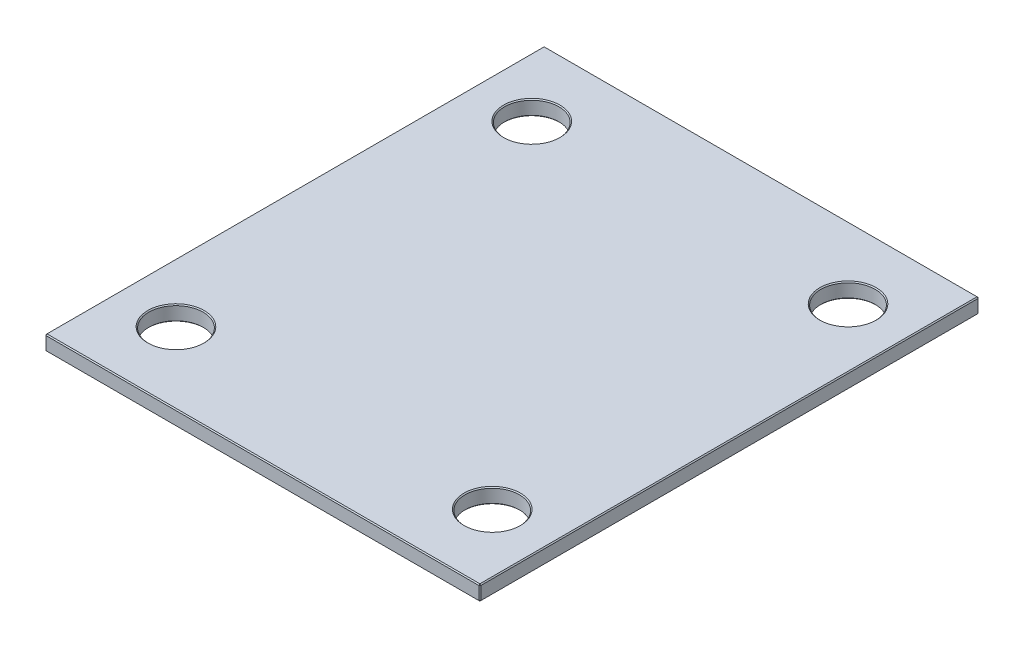
from build123d import *

# Parameters (mm, degrees)
SKETCH1_W           = 44
SKETCH1_H           = 50.5
SKETCH1_R           = 2.75
BOSS_EXTRUDE1_DEPTH = 1.524
CHAMFER1_SIZE       = 0.1


with BuildPart() as part:
    # Sketch1 → Boss-Extrude1 (new body)
    with BuildSketch(Plane(origin=(0, 0, 0), x_dir=(1, 0, 0), z_dir=(0, 1, 0))):
        Rectangle(SKETCH1_W, SKETCH1_H)
        with Locations(Location((-16, -18, 0), (0, 0, 90))):
            Circle(SKETCH1_R, mode=Mode.SUBTRACT)
        with Locations(Location((16, -18.000123839, 0), (0, 0, 90))):
            Circle(SKETCH1_R, mode=Mode.SUBTRACT)
        with Locations(Location((16, 18, 0), (0, 0, 90))):
            Circle(SKETCH1_R, mode=Mode.SUBTRACT)
        with Locations(Location((-16, 18, 0), (0, 0, 90))):
            Circle(SKETCH1_R, mode=Mode.SUBTRACT)
    extrude(amount=BOSS_EXTRUDE1_DEPTH)

    # Chamfer1
    chamfer1_edges = [part.edges().sort_by_distance(p)[0] for p in [
        (-16, 1.524, 20.75),
        (0, 0, 25.25),
        (-22, 0, 0),
        (0, 0, -25.25),
        (22, 0, 0),
        (-16, 0, -15.25),
        (16, 0, -15.25),
        (16, 0, 20.750123839),
        (-16, 0, 20.75),
        (16, 1.524, 20.750123839),
        (22, 0.762, 25.25),
        (-22, 0.762, 25.25),
        (-22, 0.762, -25.25),
        (22, 0.762, -25.25),
        (16, 1.524, -15.25),
        (-16, 1.524, -15.25),
        (22, 1.524, 0),
        (0, 1.524, -25.25),
        (-22, 1.524, 0),
        (0, 1.524, 25.25),
    ]]
    chamfer(chamfer1_edges, length=CHAMFER1_SIZE)


solid = part.part
